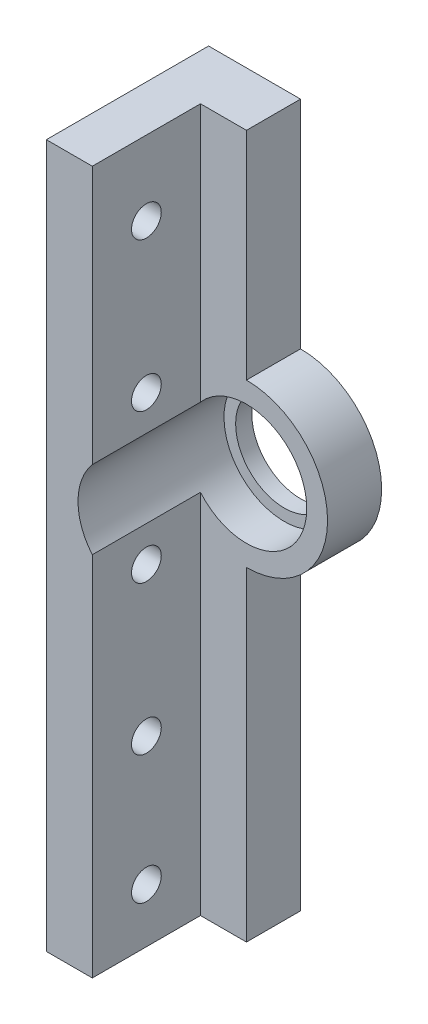
from build123d import *
from build123d.topology import SkipClean

# Parameters (mm, degrees)
SKETCH4_R           = 9
BOSS_EXTRUDE1_DEPTH = 3
BOSS_EXTRUDE3_START = 7
SKETCH5_R           = 11.15
BOSS_EXTRUDE3_DEPTH = 7
BOSS_EXTRUDE4_START = 10
BOSS_EXTRUDE4_DEPTH = 10
BOSS_EXTRUDE5_START = 10
BOSS_EXTRUDE5_DEPTH = 10
SKETCH8_R           = 2.75
CUT_EXTRUDE2_DEPTH  = 10
SKETCH10_W          = 17
SKETCH10_H          = 20
BOSS_EXTRUDE7_DEPTH = 7
SKETCH11_W          = 8.5
SKETCH11_H          = 20
BOSS_EXTRUDE8_DEPTH = 20
SKETCH12_R          = 2.75
CUT_EXTRUDE3_DEPTH  = 20


with BuildPart() as part:
    # Sketch4 → Boss-Extrude1 (new body)
    with BuildSketch(Plane(origin=(0, 0, -7), x_dir=(-1, 0, 0), z_dir=(0, 0, -1))):
        with BuildLine():
            Line((0, 55), (0, 15))
            ThreePointArc((0, 15), (-15, 0), (0, -15))
            Line((0, -15), (0, -75))
            Line((0, -75), (17, -75))
            Line((17, -75), (17, 55))
            Line((17, 55), (0, 55))
        make_face()
        Circle(SKETCH4_R, mode=Mode.SUBTRACT)
    extrude(amount=BOSS_EXTRUDE1_DEPTH)

    # Sketch5 → Boss-Extrude3 (add)
    with BuildSketch(Plane.XY.offset(-7).offset(BOSS_EXTRUDE3_START)):
        with BuildLine():
            Line((0, -55), (0, -15))
            ThreePointArc((0, -15), (15, 0), (0, 15))
            Line((0, 15), (0, 55))
            Line((0, 55), (-17, 55))
            Line((-17, 55), (-17, -55))
            Line((-17, -55), (0, -55))
        make_face()
        Circle(SKETCH5_R, mode=Mode.SUBTRACT)
    extrude(amount=-BOSS_EXTRUDE3_DEPTH)

    # Sketch6 → Boss-Extrude4 (add)
    with SkipClean():  # the faces are left unmerged after this step: merging them gives an invalid solid
        with BuildSketch(Plane.XY.offset(BOSS_EXTRUDE4_START)):
            with BuildLine():
                Line((-8.5, 7.21612777), (-8.5, 15))
                Line((-8.5, 15), (-8.5, 55))
                Line((-8.5, 55), (-17, 55))
                Line((-17, 55), (-17, -55))
                Line((-17, -55), (-8.5, -55))
                Line((-8.5, -55), (-8.5, -16.073942755))
                Line((-8.5, -16.073942755), (-8.5, -15))
                Line((-8.5, -15), (-8.5, -7.21612777))
                ThreePointArc((-8.5, -7.21612777), (-11.15, 0), (-8.5, 7.21612777))
            make_face()
        extrude(amount=-BOSS_EXTRUDE4_DEPTH)

    # Sketch7 → Boss-Extrude5 (add)
    with SkipClean():  # the faces are left unmerged after this step: merging them gives an invalid solid
        with BuildSketch(Plane.XY.offset(10).offset(BOSS_EXTRUDE5_START)):
            with BuildLine():
                Line((-8.5, 7.21612777), (-8.5, 55))
                Line((-8.5, 55), (-17, 55))
                Line((-17, 55), (-17, -55))
                Line((-17, -55), (-8.5, -55))
                Line((-8.5, -55), (-8.5, -7.21612777))
                ThreePointArc((-8.5, -7.21612777), (-11.15, 0), (-8.5, 7.21612777))
            make_face()
        extrude(amount=-BOSS_EXTRUDE5_DEPTH)

    # Sketch8 → Cut-Extrude2 (cut)
    with SkipClean():  # the faces are left unmerged after this step: merging them gives an invalid solid
        with BuildSketch(Plane(origin=(-8.5, 0, 0), x_dir=(0, 0, -1), z_dir=(1, 0, 0))):
            with BuildLine():
                ThreePointArc((-7.25, 41.25), (-8.055456352, 43.194543648), (-10, 44))
                Line((-10, 44), (-10, 38.5))
                ThreePointArc((-10, 38.5), (-8.055456352, 39.305456352), (-7.25, 41.25))
            make_face()
            with BuildLine():
                Line((-10, 38.5), (-10, 44))
                ThreePointArc((-10, 44), (-12.75, 41.25), (-10, 38.5))
            make_face()
            with Locations((-10, 13.75)):
                Circle(SKETCH8_R)
            with Locations((-10, -13.75)):
                Circle(SKETCH8_R)
            with Locations((-10, -41.25)):
                Circle(SKETCH8_R)
        extrude(amount=-CUT_EXTRUDE2_DEPTH, mode=Mode.SUBTRACT)

    # Sketch10 → Boss-Extrude7 (add)
    with SkipClean():  # the faces are left unmerged after this step: merging them gives an invalid solid
        with BuildSketch(Plane.XY.offset(-7)):
            with Locations((-8.5, -65)):
                Rectangle(SKETCH10_W, SKETCH10_H)
        extrude(amount=BOSS_EXTRUDE7_DEPTH)

    # Sketch11 → Boss-Extrude8 (add)
    with SkipClean():  # the faces are left unmerged after this step: merging them gives an invalid solid
        with BuildSketch(Plane.XZ.offset(55)):
            with Locations((-12.75, 10)):
                Rectangle(SKETCH11_W, SKETCH11_H)
        extrude(amount=BOSS_EXTRUDE8_DEPTH)

    # Sketch12 → Cut-Extrude3 (cut)
    with SkipClean():  # the faces are left unmerged after this step: merging them gives an invalid solid
        with BuildSketch(Plane(origin=(-8.5, 0, 0), x_dir=(0, 0, -1), z_dir=(1, 0, 0))):
            with Locations(Location((-10, -65, 0), (0, 0, 90))):
                Circle(SKETCH12_R)
        extrude(amount=-CUT_EXTRUDE3_DEPTH, mode=Mode.SUBTRACT)


solid = part.part
